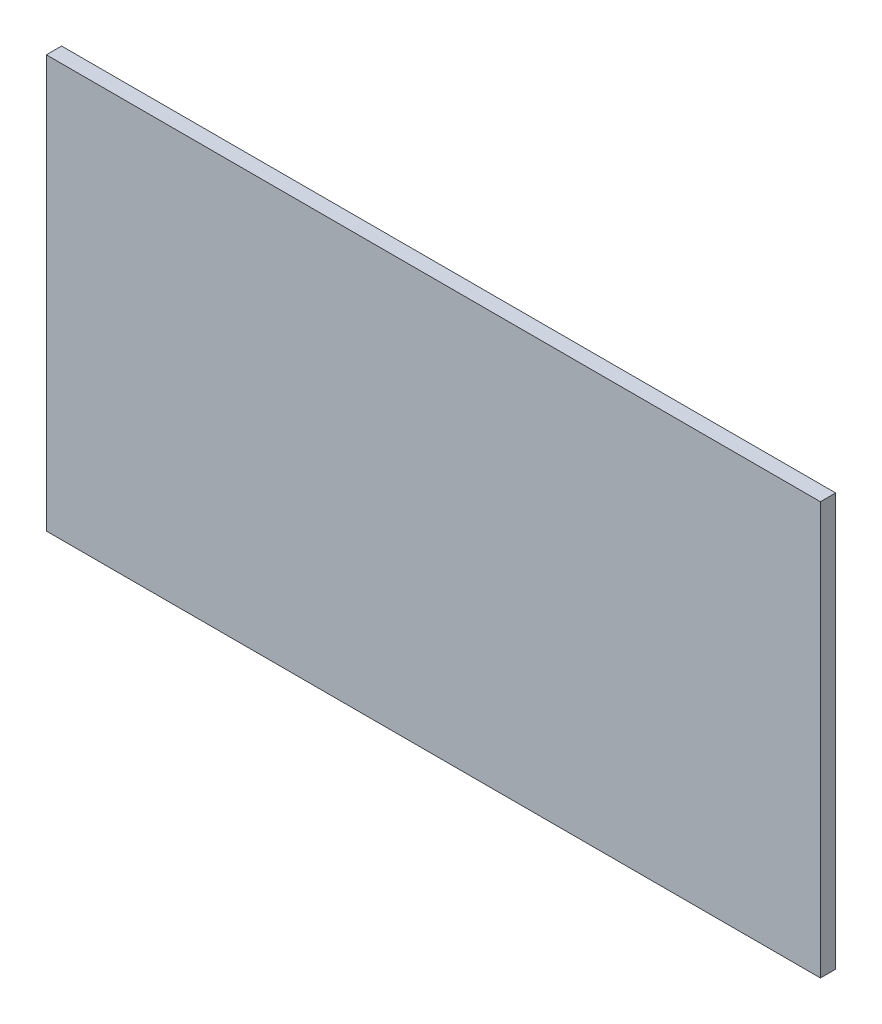
from build123d import *

# Parameters (mm, degrees)
SKETCH1_W           = 304.8
SKETCH1_H           = 162.4
BOSS_EXTRUDE1_DEPTH = 6


with BuildPart() as part:
    # Sketch1 → Boss-Extrude1 (new body)
    with BuildSketch(Plane.XY):
        Rectangle(SKETCH1_W, SKETCH1_H)
    extrude(amount=BOSS_EXTRUDE1_DEPTH)


solid = part.part
